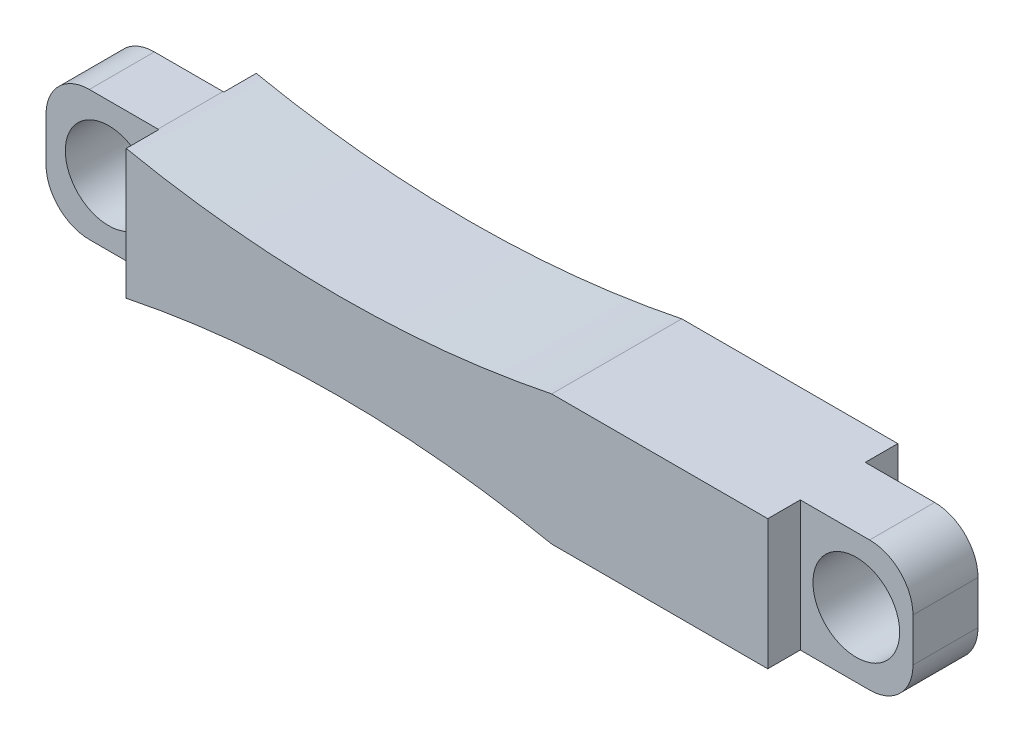
from build123d import *

# Parameters (mm, degrees)
SKETCH1_W           = 200
SKETCH1_H           = 30
BOSS_EXTRUDE1_DEPTH = 30
FILLET1_R           = 10
CUT_EXTRUDE1_DEPTH  = 30
SKETCH3_W           = 7.5
SKETCH3_H           = 30
CUT_EXTRUDE2_DEPTH  = 26
SKETCH4_W           = 7.5
SKETCH4_H           = 30
CUT_EXTRUDE3_DEPTH  = 26
SKETCH5_R           = 10
CUT_EXTRUDE4_DEPTH  = 45
SCALE1_SCALE        = 4


with BuildPart() as part:
    # Sketch1 → Boss-Extrude1 (new body)
    with BuildSketch(Plane.XY):
        with Locations((46.259717806, -4.797058824)):
            Rectangle(SKETCH1_W, SKETCH1_H)
    extrude(amount=BOSS_EXTRUDE1_DEPTH)

    # Fillet1
    fillet1_edges = [part.edges().sort_by_distance(p)[0] for p in [
        (-53.740282194, 10.202941176, 15),
        (146.259717806, 10.202941176, 15),
        (146.259717806, -19.797058824, 15),
        (-53.740282194, -19.797058824, 15),
    ]]
    fillet(fillet1_edges, radius=FILLET1_R)

    # Sketch2 → Cut-Extrude1 (cut)
    with BuildSketch(Plane.XY.offset(30)):
        with BuildLine():
            Line((-27.901084514, 10.202941176), (70.420520136, 10.202941176))
            ThreePointArc((70.420520136, 10.202941176), (21.259717811, 5.202941178), (-27.901084514, 10.202941176))
        make_face()
        with BuildLine():
            Line((-27.901084524, -19.797058824), (70.420520136, -19.797058824))
            ThreePointArc((70.420520136, -19.797058824), (21.259717806, -14.798405243), (-27.901084524, -19.797058824))
        make_face()
    extrude(amount=-CUT_EXTRUDE1_DEPTH, mode=Mode.SUBTRACT)

    # Sketch3 → Cut-Extrude2 (cut)
    with BuildSketch(Plane(origin=(146.259717806, 0, 0), x_dir=(0, 0, -1), z_dir=(1, 0, 0))):
        with Locations((-3.75, -4.797058824)):
            Rectangle(SKETCH3_W, SKETCH3_H)
        with Locations((-26.25, -4.797058824)):
            Rectangle(SKETCH3_W, SKETCH3_H)
    extrude(amount=-CUT_EXTRUDE2_DEPTH, mode=Mode.SUBTRACT)

    # Sketch4 → Cut-Extrude3 (cut)
    with BuildSketch(Plane.ZY.offset(53.740282194)):
        with Locations((26.25, -4.797058824)):
            Rectangle(SKETCH4_W, SKETCH4_H)
        with Locations((3.75, -4.797058824)):
            Rectangle(SKETCH4_W, SKETCH4_H)
    extrude(amount=-CUT_EXTRUDE3_DEPTH, mode=Mode.SUBTRACT)

    # Sketch5 → Cut-Extrude4 (cut)
    with BuildSketch(Plane.XY.offset(30)):
        with Locations((-39.286224807, -4.797058824)):
            Circle(SKETCH5_R)
        with Locations((133.184735123, -4.797058824)):
            Circle(SKETCH5_R)
    extrude(amount=-CUT_EXTRUDE4_DEPTH, mode=Mode.SUBTRACT)


with BuildPart() as part_1:
    # Scale1: scaled about (50.111608126, -4.79729109, 15)
    add(part.part.scale(SCALE1_SCALE).moved(Location((-150.334824378, 14.39187327, -45))))


solid = part_1.part
